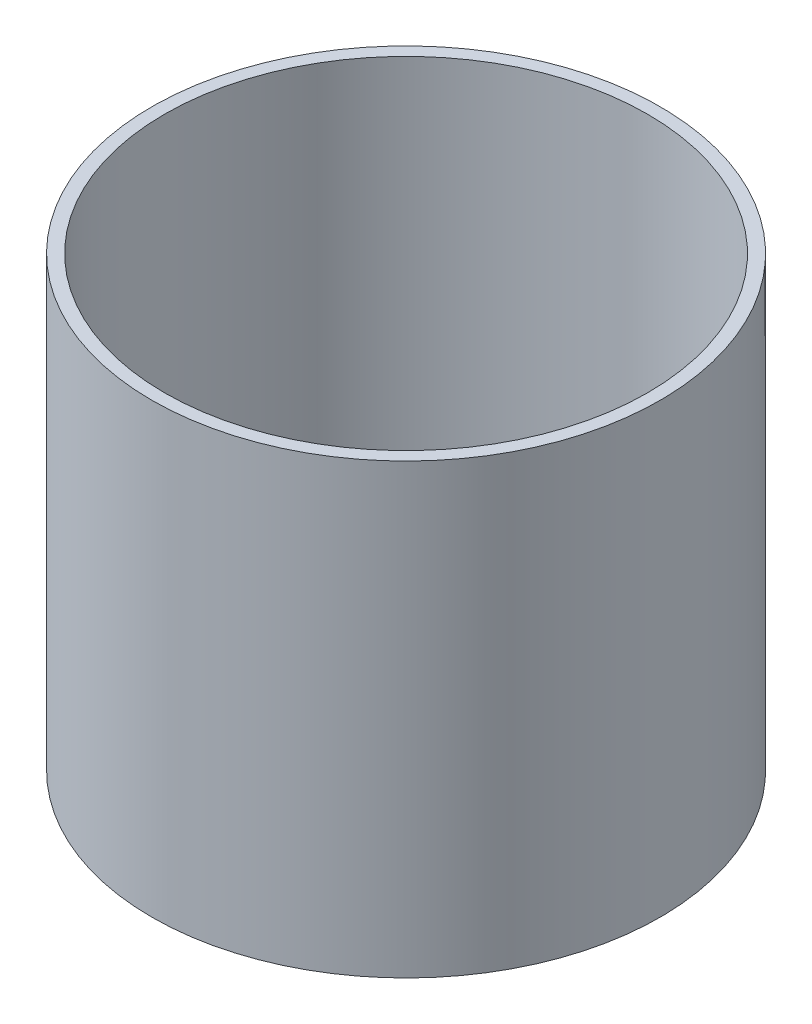
from build123d import *

# Parameters (mm, degrees)
SKETCH1_R           = 39.75
SKETCH1_R_2         = 37.75
BOSS_EXTRUDE1_DEPTH = 70


with BuildPart() as part:
    # Sketch1 → Boss-Extrude1 (new body)
    with BuildSketch(Plane(origin=(0, 0, 0), x_dir=(1, 0, 0), z_dir=(0, 1, 0))):
        with Locations(Location((0, 0, 0), (0, 0, 270))):
            Circle(SKETCH1_R)
        with Locations(Location((0, 0, 0), (0, 0, 270))):
            Circle(SKETCH1_R_2, mode=Mode.SUBTRACT)
    extrude(amount=BOSS_EXTRUDE1_DEPTH)


solid = part.part
